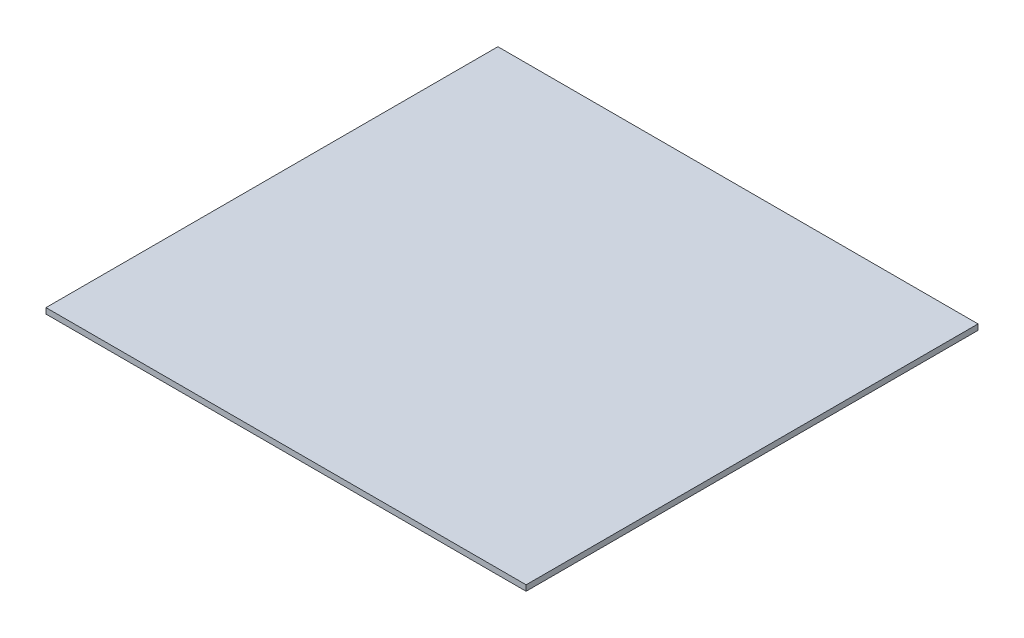
from build123d import *

# Parameters (mm, degrees)
SKETCH1_W           = 431.8
SKETCH1_H           = 406.4
BOSS_EXTRUDE1_DEPTH = 5.08


with BuildPart() as part:
    # Sketch1 → Boss-Extrude1 (new body)
    with BuildSketch(Plane(origin=(0, 0, 0), x_dir=(1, 0, 0), z_dir=(0, 1, 0))):
        Rectangle(SKETCH1_W, SKETCH1_H)
    extrude(amount=BOSS_EXTRUDE1_DEPTH)


solid = part.part
